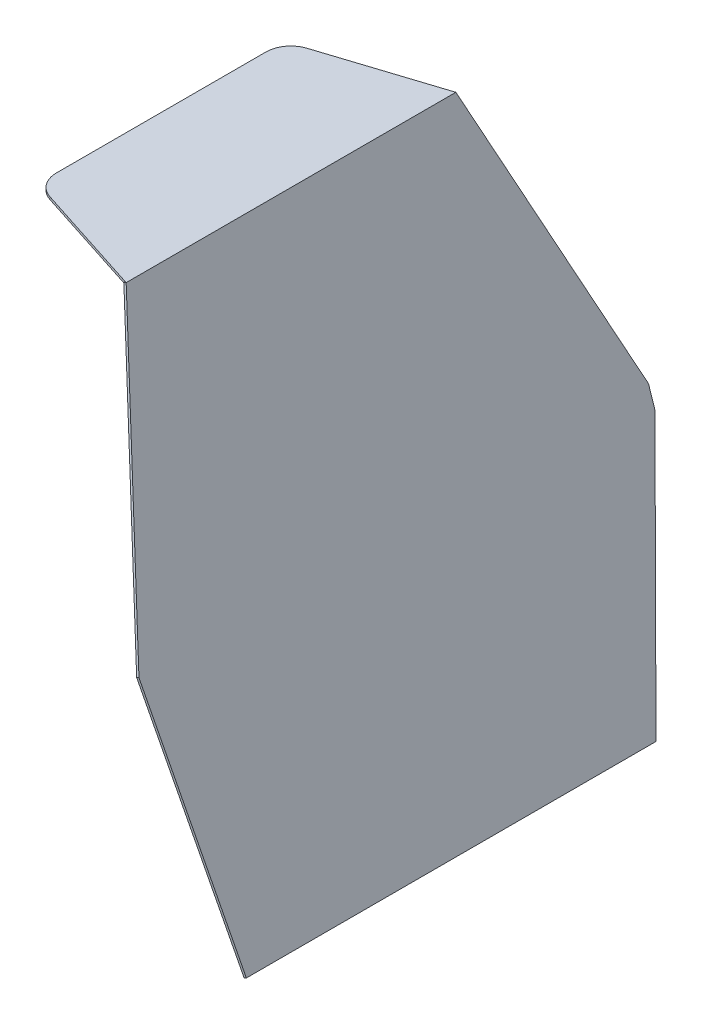
from build123d import *

# Parameters (mm, degrees)
BOSS_EXTRUDE2_DEPTH = 3.175
BOSS_EXTRUDE3_DEPTH = 3.175
CUT_EXTRUDE2_DEPTH  = 958.917567573


with BuildPart() as part:
    # Sketch3 → Boss-Extrude2 (new body)
    with BuildSketch(Plane(origin=(0, 0, 0), x_dir=(0, 0, -1), z_dir=(0.9227400229187457, 0.3854229496331436, 0))):
        Polygon((0, 0), (609.6, 0), (628.65, 304.8), (514.35, 643.582154794), (95.25, 643.582154794), (-19.05, 304.8), align=None)
    extrude(amount=BOSS_EXTRUDE2_DEPTH)

    # Sketch4 → Boss-Extrude3 (add)
    with BuildSketch(Plane(origin=(0, 595.08273013, 0), x_dir=(1, 0, 0), z_dir=(0, 1, 0))):
        with BuildLine():
            Line((-245.121632859, 514.35), (-388.214384584, 468.215025945))
            ThreePointArc((-388.214384584, 468.215025945), (-404.136734332, 456.688108103), (-410.221632859, 437.996798187))
            Line((-410.221632859, 437.996798187), (-410.221632859, 171.603201813))
            ThreePointArc((-410.221632859, 171.603201813), (-404.136734332, 152.911891897), (-388.214384584, 141.384974055))
            Line((-388.214384584, 141.384974055), (-245.121632859, 95.25))
            Line((-245.121632859, 95.25), (-245.121632859, 514.35))
        make_face()
    extrude(amount=-BOSS_EXTRUDE3_DEPTH)

    # Sketch5 → Cut-Extrude2 (cut, through all)
    with BuildSketch(Plane(origin=(0, 0, 0), x_dir=(0, 0, -1), z_dir=(0.9227400229187457, 0.3854229496331436, 0))):
        Polygon((609.6, 0), (627.0625, 279.4), (520.7, 0), align=None)
    extrude(amount=CUT_EXTRUDE2_DEPTH, mode=Mode.SUBTRACT)


solid = part.part
